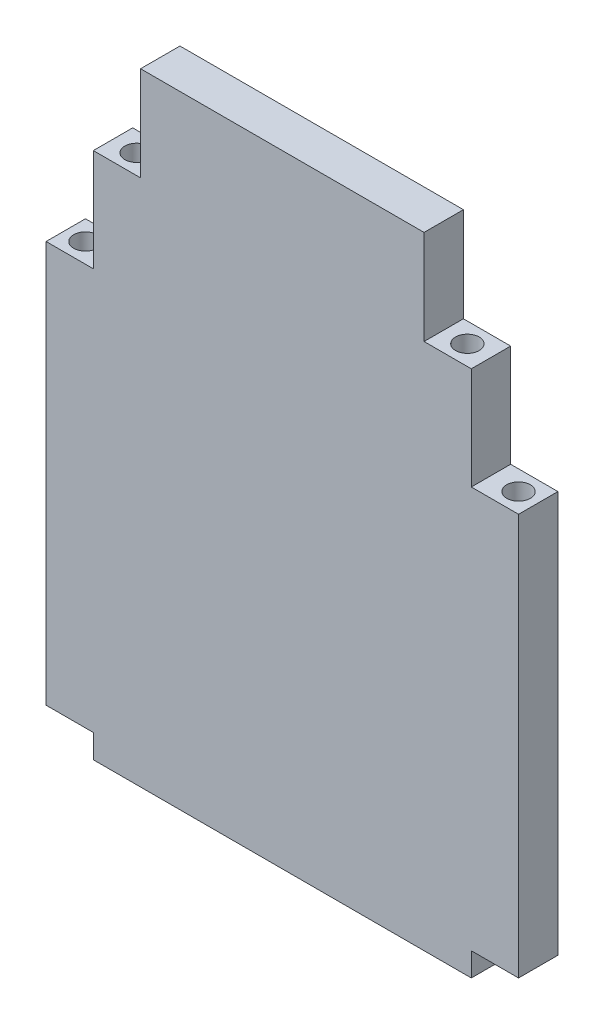
from build123d import *

# Parameters (mm, degrees)
EXTRUDE_1_DEPTH     = 5
SKETCH_2_R          = 1.5
CUT_EXTRUDE_1_DEPTH = 10
SKETCH_3_R          = 1.5
CUT_EXTRUDE_2_DEPTH = 10


with BuildPart() as part:
    # ｽｹｯﾁ1 → ﾎﾞｽ - 押し出し1 (new body)
    with BuildSketch(Plane.XY):
        Polygon((30, -25.5), (30, 25.5), (24, 25.5), (24, 38.5), (18, 38.5), (18, 50.5), (-18, 50.5), (-18, 38.5), (-24, 38.5), (-24, 25.5), (-30, 25.5), (-30, -25.5), (-24, -25.5), (-24, -28.5), (24, -28.5), (24, -25.5), align=None)
    extrude(amount=EXTRUDE_1_DEPTH)

    # ｽｹｯﾁ2 → ｶｯﾄ - 押し出し1 (cut)
    with BuildSketch(Plane(origin=(0, 25.5, 0), x_dir=(1, 0, 0), z_dir=(0, 1, 0))):
        with Locations(Location((-27.5, -2.5, 0), (0, 0, 180))):
            Circle(SKETCH_2_R)
        with Locations((27.5, -2.5)):
            Circle(SKETCH_2_R)
    cut_extrude_1 = extrude(amount=-CUT_EXTRUDE_1_DEPTH, mode=Mode.SUBTRACT)

    # ﾐﾗｰ1: ｶｯﾄ - 押し出し1 across plane
    add(cut_extrude_1.mirror(Plane.ZX), mode=Mode.SUBTRACT)

    # ｽｹｯﾁ3 → ｶｯﾄ - 押し出し2 (cut)
    with BuildSketch(Plane(origin=(0, 38.5, 0), x_dir=(1, 0, 0), z_dir=(0, 1, 0))):
        with Locations(Location((-21, -2.5, 0), (0, 0, 270))):
            Circle(SKETCH_3_R)
        with Locations(Location((21, -2.5, 0), (0, 0, 90))):
            Circle(SKETCH_3_R)
    extrude(amount=-CUT_EXTRUDE_2_DEPTH, mode=Mode.SUBTRACT)


solid = part.part
